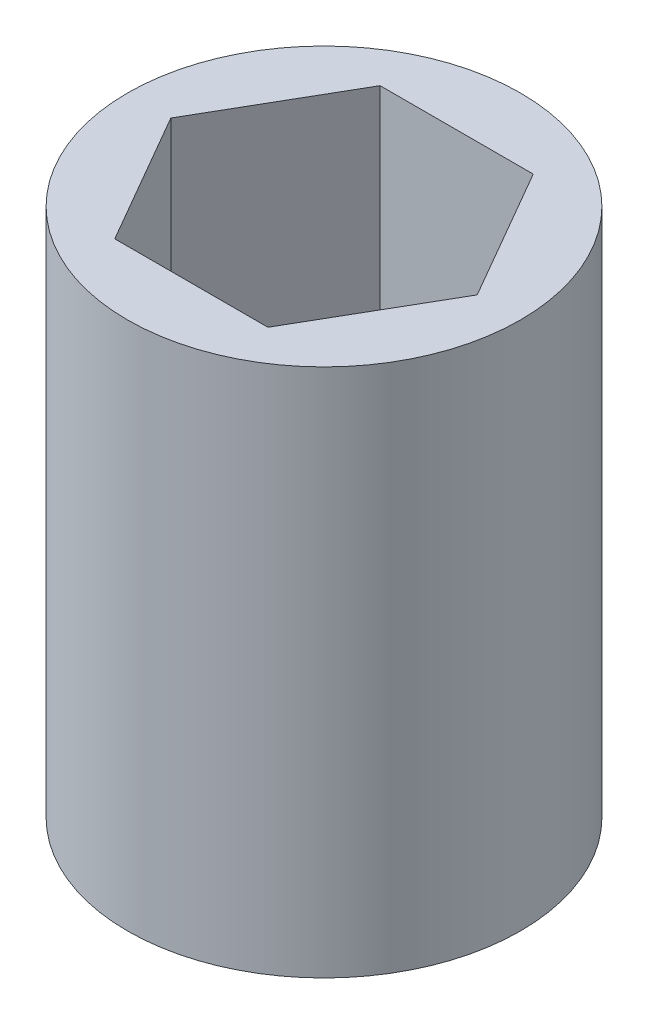
from build123d import *

# Parameters (mm, degrees)
SKETCH1_R           = 10.16
BOSS_EXTRUDE1_DEPTH = 27.35834


with BuildPart() as part:
    # Sketch1 → Boss-Extrude1 (new body)
    with BuildSketch(Plane(origin=(0, 0, 0), x_dir=(1, 0, 0), z_dir=(0, 1, 0))):
        with Locations(Location((0, 0, 0), (0, 0, 270))):
            Circle(SKETCH1_R)
        Polygon((7.918936292, 0), (3.959468146, 6.858), (-3.959468146, 6.858), (-7.918936292, 0), (-3.959468146, -6.858), (3.959468146, -6.858), align=None, mode=Mode.SUBTRACT)
    extrude(amount=BOSS_EXTRUDE1_DEPTH)


solid = part.part
